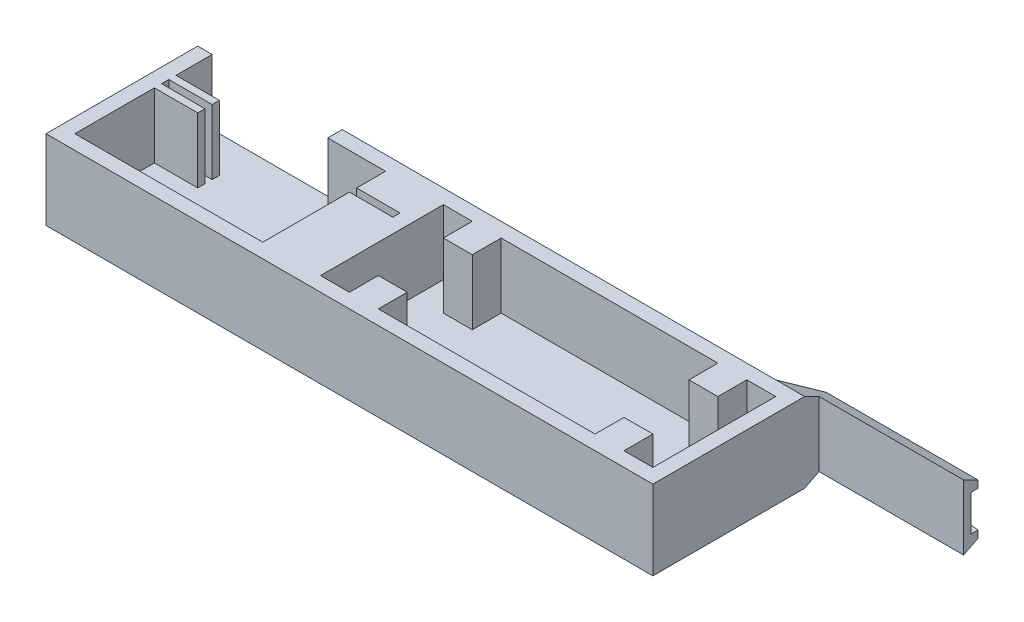
from build123d import *

# Parameters (mm, degrees)
BOSS_EXTRUDE1_DEPTH = 2
SKETCH1_4_W         = 46
SKETCH1_4_H         = 17
BOSS_EXTRUDE2_DEPTH = 11
SKETCH2_W           = 6
SKETCH2_H           = 3
SKETCH2_H_2         = 11
CUT_EXTRUDE1_DEPTH  = 9
SKETCH3_W           = 18
SKETCH3_H           = 9
CUT_EXTRUDE2_DEPTH  = 2
SKETCH4_W           = 4
SKETCH4_H           = 4
BOSS_EXTRUDE3_DEPTH = 9
SKETCH5_R           = 0.5
CUT_EXTRUDE3_DEPTH  = 1
CUT_EXTRUDE4_DEPTH  = 24


with BuildPart() as part:
    # Sketch1 → Boss-Extrude1 (new body)
    with BuildSketch(Plane(origin=(0, 0, 0), x_dir=(1, 0, 0), z_dir=(0, 1, 0))):
        Polygon((-42, 10.5), (-42, -10.5), (42, -10.5), (42, 12.5), (62, 12.5), (62, 14.5), (41, 14.5), (38, 10.5), align=None)
    extrude(amount=BOSS_EXTRUDE1_DEPTH)

    # Sketch1<4> → Boss-Extrude2 (add)
    with BuildSketch(Plane(origin=(0, 0, 0), x_dir=(1, 0, 0), z_dir=(0, 1, 0))):
        Polygon((-42, 10.5), (-42, -10.5), (42, -10.5), (42, 12.5), (62, 12.5), (62, 14.5), (41, 14.5), (38, 10.5), align=None)
        Polygon((-14, 3.5), (-14, -8.5), (-34, -8.5), (-34, 3.5), (-40, 3.5), (-40, 4.5), (-34, 4.5), (-34, 8.5), (-14, 8.5), (-14, 4.5), (-8, 4.5), (-8, 3.5), align=None, mode=Mode.SUBTRACT)
        with Locations((17, 0)):
            Rectangle(SKETCH1_4_W, SKETCH1_4_H, mode=Mode.SUBTRACT)
    extrude(amount=BOSS_EXTRUDE2_DEPTH)

    # Sketch2 → Cut-Extrude1 (cut)
    with BuildSketch(Plane(origin=(0, 11, 0), x_dir=(1, 0, 0), z_dir=(0, 1, 0))):
        with Locations((-37, 7)):
            Rectangle(SKETCH2_W, SKETCH2_H)
        with Locations((-37, -3)):
            Rectangle(SKETCH2_W, SKETCH2_H_2)
    extrude(amount=-CUT_EXTRUDE1_DEPTH, mode=Mode.SUBTRACT)

    # Sketch3 → Cut-Extrude2 (cut)
    with BuildSketch(Plane(origin=(0, 0, -10.5), x_dir=(-1, 0, 0), z_dir=(0, 0, -1))):
        with Locations((31, 6.5)):
            Rectangle(SKETCH3_W, SKETCH3_H)
    extrude(amount=-CUT_EXTRUDE2_DEPTH, mode=Mode.SUBTRACT)

    # Sketch4 → Boss-Extrude3 (add)
    with BuildSketch(Plane(origin=(0, 2, 0), x_dir=(1, 0, 0), z_dir=(0, 1, 0))):
        with Locations((0, 6.5)):
            Rectangle(SKETCH4_W, SKETCH4_H)
        with Locations((0, -6.5)):
            Rectangle(SKETCH4_W, SKETCH4_H)
        with Locations((34, 6.5)):
            Rectangle(SKETCH4_W, SKETCH4_H)
        with Locations((34, -6.5)):
            Rectangle(SKETCH4_W, SKETCH4_H)
    extrude(amount=BOSS_EXTRUDE3_DEPTH)

    # Sketch5 → Cut-Extrude3 (cut)
    with BuildSketch(Plane(origin=(0, 0, -14.5), x_dir=(-1, 0, 0), z_dir=(0, 0, -1))):
        with BuildLine():
            Line((-62, 8), (-62, 3))
            Line((-62, 3), (-53.5, 4))
            ThreePointArc((-53.5, 4), (-52, 5.5), (-53.5, 7))
            Line((-53.5, 7), (-62, 8))
        make_face()
        with Locations((-58.5, 5.5)):
            Circle(SKETCH5_R, mode=Mode.SUBTRACT)
        with Locations((-56, 5.5)):
            Circle(SKETCH5_R, mode=Mode.SUBTRACT)
        with Locations((-53.5, 5.5)):
            Circle(SKETCH5_R, mode=Mode.SUBTRACT)
    extrude(amount=-CUT_EXTRUDE3_DEPTH, mode=Mode.SUBTRACT)

    # Sketch6 → Cut-Extrude4 (cut)
    with BuildSketch(Plane(origin=(62, 0, 0), x_dir=(0, 0, -1), z_dir=(1, 0, 0))):
        Polygon((10.5, 11), (14.5, 11), (14.5, 9), align=None)
        Polygon((10.5, 0), (14.5, 2), (14.5, 0), align=None)
    extrude(amount=-CUT_EXTRUDE4_DEPTH, mode=Mode.SUBTRACT)


solid = part.part
